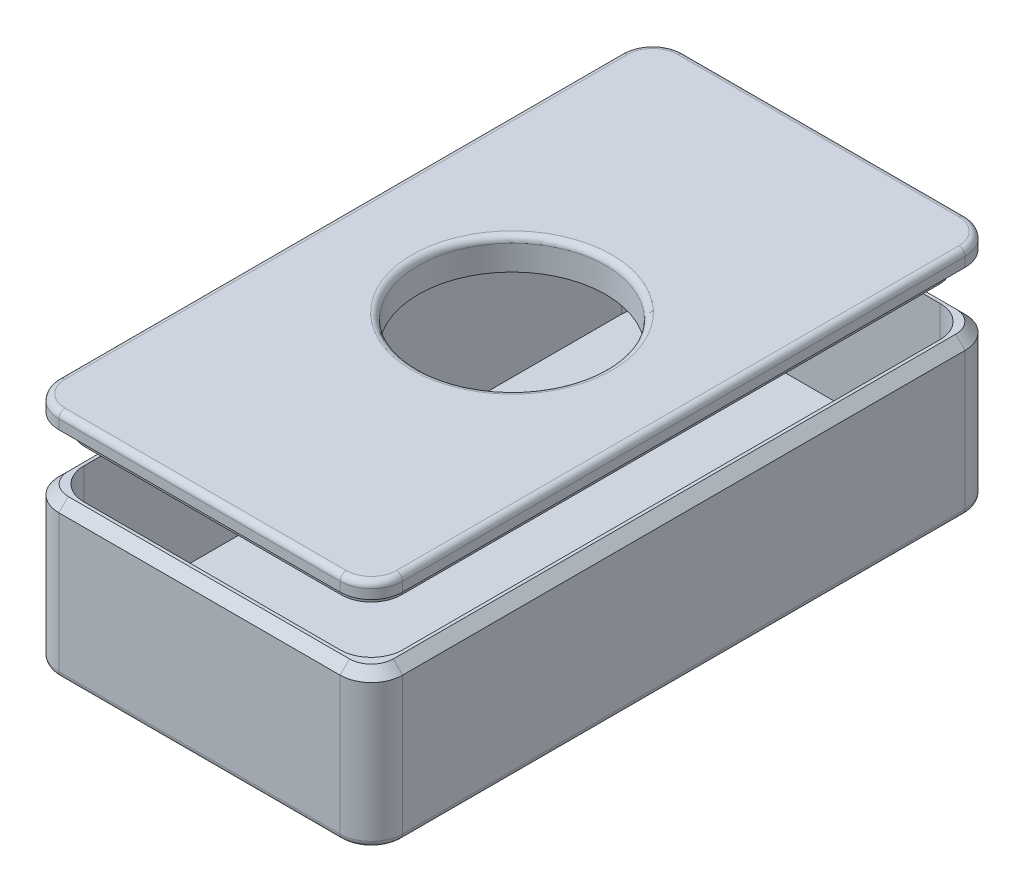
from build123d import *

# Parameters (mm, degrees)
SKETCH1_W           = 55
SKETCH1_H           = 100
SKETCH1_W_2         = 51
SKETCH1_H_2         = 96
BOSS_EXTRUDE1_DEPTH = 22
SKETCH2_W           = 55
SKETCH2_H           = 100
BOSS_EXTRUDE2_DEPTH = 2.5
FILLET1_R           = 5
SKETCH3_W           = 55
SKETCH3_H           = 100
BOSS_EXTRUDE3_DEPTH = 2.5
BOSS_EXTRUDE4_DEPTH = 2.5
BOSS_EXTRUDE4_DRAFT = -5
FILLET2_R           = 5
FILLET3_R           = 1
FILLET4_R           = 5
CHAMFER1_SIZE       = 1.5
FILLET5_R           = 1
SKETCH4_R           = 15
CUT_EXTRUDE1_DEPTH  = 5
FILLET6_R           = 1


with BuildPart() as part:
    # Sketch1 → Boss-Extrude1 (new body)
    with BuildSketch(Plane(origin=(0, 0, 0), x_dir=(1, 0, 0), z_dir=(0, 1, 0))):
        with Locations((25.5, 48)):
            Rectangle(SKETCH1_W, SKETCH1_H)
        with Locations((25.5, 48)):
            Rectangle(SKETCH1_W_2, SKETCH1_H_2, mode=Mode.SUBTRACT)
    extrude(amount=BOSS_EXTRUDE1_DEPTH)

    # Sketch2 → Boss-Extrude2 (add)
    with BuildSketch(Plane.XZ):
        with Locations((25.5, -48)):
            Rectangle(SKETCH2_W, SKETCH2_H)
    extrude(amount=BOSS_EXTRUDE2_DEPTH)

    # Fillet1
    fillet1_edges = [part.edges().sort_by_distance(p)[0] for p in [
        (0, 11, -96),
        (0, 11, 0),
        (51, 11, 0),
        (51, 11, -96),
    ]]
    fillet(fillet1_edges, radius=FILLET1_R)

    # Fillet4
    fillet4_edges = [part.edges().sort_by_distance(p)[0] for p in [
        (-2, 9.75, -98),
        (53, 9.75, -98),
        (53, 9.75, 2),
        (-2, 9.75, 2),
    ]]
    fillet(fillet4_edges, radius=FILLET4_R)

    # Chamfer1
    chamfer1_edges = [part.edges().sort_by_distance(p)[0] for p in [
        (53, 22, -48),
        (25.5, 22, 2),
        (-2, 22, -48),
        (25.5, 22, -98),
        (-0.535533906, 22, 0.535533906),
        (-0.535533906, 22, -96.535533906),
        (51.535533906, 22, -96.535533906),
        (51.535533906, 22, 0.535533906),
    ]]
    chamfer(chamfer1_edges, length=CHAMFER1_SIZE)

    # Fillet5
    fillet5_edges = [part.edges().sort_by_distance(p)[0] for p in [
        (53, -2.5, -48),
        (25.5, -2.5, 2),
        (-2, -2.5, -48),
        (25.5, -2.5, -98),
        (-0.535533906, -2.5, 0.535533906),
        (-0.535533906, -2.5, -96.535533906),
        (51.535533906, -2.5, -96.535533906),
        (51.535533906, -2.5, 0.535533906),
    ]]
    fillet(fillet5_edges, radius=FILLET5_R)


with BuildPart() as body_2:
    # Sketch3 → Boss-Extrude3 (new body)
    with BuildSketch(Plane(origin=(0, 32, 0), x_dir=(1, 0, 0), z_dir=(0, 1, 0))):
        with Locations((25.5, 48)):
            Rectangle(SKETCH3_W, SKETCH3_H)
    extrude(amount=BOSS_EXTRUDE3_DEPTH)


with BuildPart() as boss_extrude4_tool:
    # Sketch3<3> → Boss-Extrude4 (with draft: the straight prism first)
    with BuildSketch(Plane(origin=(0, 32, 0), x_dir=(1, 0, 0), z_dir=(0, 1, 0))):
        with BuildLine():
            Line((51, 5), (51, 91))
            ThreePointArc((51, 91), (49.535533906, 94.535533906), (46, 96))
            Line((46, 96), (5, 96))
            ThreePointArc((5, 96), (1.464466094, 94.535533906), (0, 91))
            Line((0, 91), (0, 5))
            ThreePointArc((0, 5), (1.464466094, 1.464466094), (5, 0))
            Line((5, 0), (46, 0))
            ThreePointArc((46, 0), (49.535533906, 1.464466094), (51, 5))
        make_face()
    extrude(amount=-BOSS_EXTRUDE4_DEPTH)
    # Boss-Extrude4: the draft: its side faces are tilted about the plane it starts from
    boss_extrude4_sides = [boss_extrude4_tool.faces().sort_by_distance(p)[0] for p in [
        (51, 30.75, -48),
        (49.535533906, 30.75, -94.535533906),
        (25.5, 30.75, -96),
        (1.464466094, 30.75, -94.535533906),
        (0, 30.75, -48),
        (1.464466094, 30.75, -1.464466094),
        (25.5, 30.75, 0),
        (49.535533906, 30.75, -1.464466094),
    ]]
    draft(boss_extrude4_sides, Plane(origin=(0, 32, 0), x_dir=(1, 0, 0), z_dir=(0, 1, 0)), BOSS_EXTRUDE4_DRAFT)


with BuildPart() as body_2_1:
    add(body_2.part)

    # Boss-Extrude4: add boss_extrude4_tool
    add(boss_extrude4_tool.part)

    # Fillet2
    fillet2_edges = [body_2_1.edges().sort_by_distance(p)[0] for p in [
        (53, 33.25, -98),
        (53, 33.25, 2),
        (-2, 33.25, 2),
        (-2, 33.25, -98),
    ]]
    fillet(fillet2_edges, radius=FILLET2_R)

    # Fillet3
    fillet3_edges = [body_2_1.edges().sort_by_distance(p)[0] for p in [
        (-2, 34.5, -48),
        (25.5, 34.5, -98),
        (25.5, 34.5, 2),
        (53, 34.5, -48),
        (-0.535533906, 34.5, 0.535533906),
        (51.535533906, 34.5, 0.535533906),
        (51.535533906, 34.5, -96.535533906),
        (-0.535533906, 34.5, -96.535533906),
    ]]
    fillet(fillet3_edges, radius=FILLET3_R)

    # Sketch4 → Cut-Extrude1 (cut)
    with BuildSketch(Plane(origin=(0, 34.5, 0), x_dir=(1, 0, 0), z_dir=(0, 1, 0))):
        with Locations(Location((25.5, 48, 0), (0, 0, 270))):
            Circle(SKETCH4_R)
    extrude(amount=-CUT_EXTRUDE1_DEPTH, mode=Mode.SUBTRACT)

    # Fillet6
    fillet6_edges = [body_2_1.edges().sort_by_distance(p)[0] for p in [
        (25.5, 34.5, -63),
    ]]
    fillet(fillet6_edges, radius=FILLET6_R)


solid = Compound([part.part, body_2_1.part])
